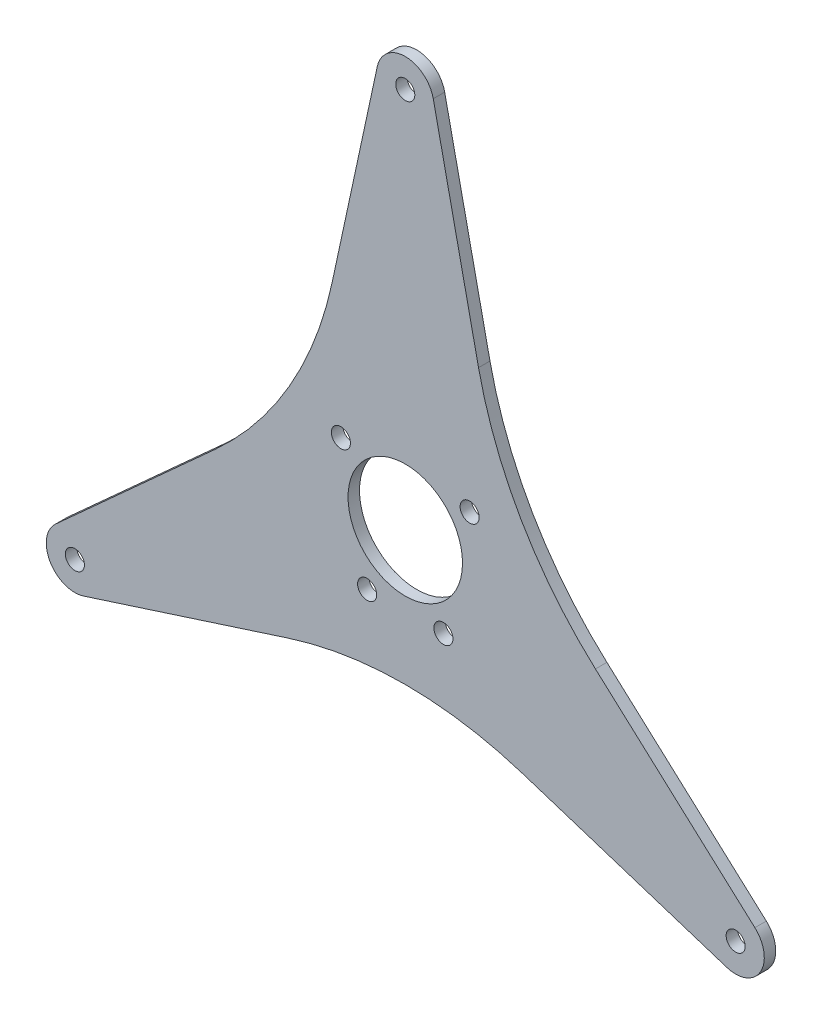
from build123d import *

# Parameters (mm, degrees)
SKETCH1_R           = 5
SKETCH1_R_2         = 30
BOSS_EXTRUDE1_DEPTH = 6


with BuildPart() as part:
    # Sketch1 → Boss-Extrude1 (new body)
    with BuildSketch(Plane.XY):
        with BuildLine():
            Line((-183.272280019, -88.88013044), (-99.69088835, -13.21103019))
            ThreePointArc((-99.69088835, -13.21103019), (-60.715131082, 35.053897274), (-38.40435642, 92.940356932))
            Line((-38.40435642, 92.940356932), (-14.663689156, 203.158515526))
            ThreePointArc((-14.663689156, 203.158515526), (0, 215), (14.663689156, 203.158515526))
            Line((14.663689156, 203.158515526), (38.40435642, 92.940356932))
            ThreePointArc((38.40435642, 92.940356932), (60.715131082, 35.053897274), (99.69088835, -13.21103019))
            Line((99.69088835, -13.21103019), (183.272280019, -88.88013044))
            ThreePointArc((183.272280019, -88.88013044), (186.195461814, -107.5), (168.608590862, -114.278385085))
            Line((168.608590862, -114.278385085), (61.28653193, -79.729326742))
            ThreePointArc((61.28653193, -79.729326742), (0, -70.107794548), (-61.28653193, -79.729326742))
            Line((-61.28653193, -79.729326742), (-168.608590862, -114.278385085))
            ThreePointArc((-168.608590862, -114.278385085), (-186.195461814, -107.5), (-183.272280019, -88.88013044))
        make_face()
        with Locations((0, 200)):
            Circle(SKETCH1_R, mode=Mode.SUBTRACT)
        with Locations((173.205080757, -100)):
            Circle(SKETCH1_R, mode=Mode.SUBTRACT)
        with Locations((-173.205080757, -100)):
            Circle(SKETCH1_R, mode=Mode.SUBTRACT)
        Circle(SKETCH1_R_2, mode=Mode.SUBTRACT)
        with Locations((-33.75, 25.061076609)):
            Circle(SKETCH1_R, mode=Mode.SUBTRACT)
        with Locations((33.75, 25.061076609)):
            Circle(SKETCH1_R, mode=Mode.SUBTRACT)
        with Locations((-20, -36.932370625)):
            Circle(SKETCH1_R, mode=Mode.SUBTRACT)
        with Locations((20, -36.932370625)):
            Circle(SKETCH1_R, mode=Mode.SUBTRACT)
    extrude(amount=BOSS_EXTRUDE1_DEPTH)


solid = part.part
